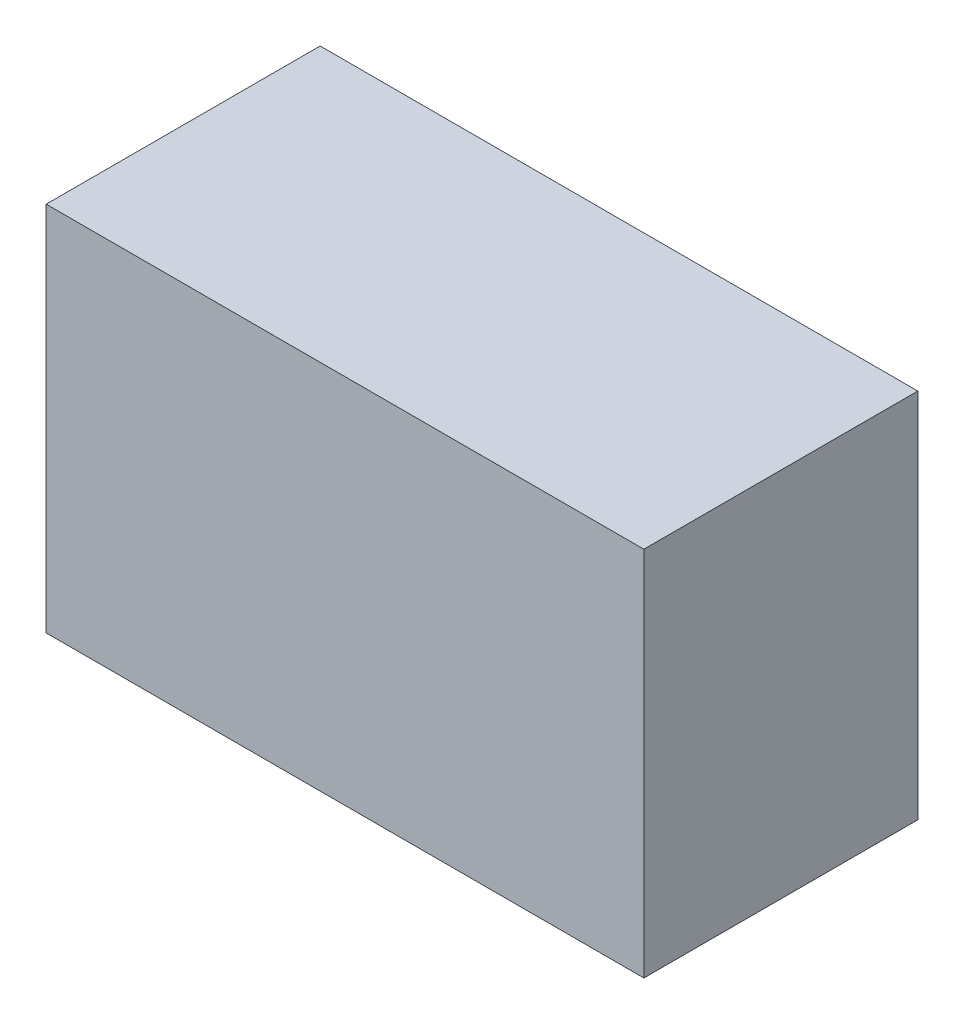
from build123d import *

# Parameters (mm, degrees)
SKETCH1_W           = 86.868
SKETCH1_H           = 39.8145
BOSS_EXTRUDE1_DEPTH = 53.975


with BuildPart() as part:
    # Sketch1 → Boss-Extrude1 (new body)
    with BuildSketch(Plane(origin=(0, 0, 0), x_dir=(1, 0, 0), z_dir=(0, 1, 0))):
        with Locations((43.434, 19.90725)):
            Rectangle(SKETCH1_W, SKETCH1_H)
    extrude(amount=BOSS_EXTRUDE1_DEPTH)


solid = part.part
